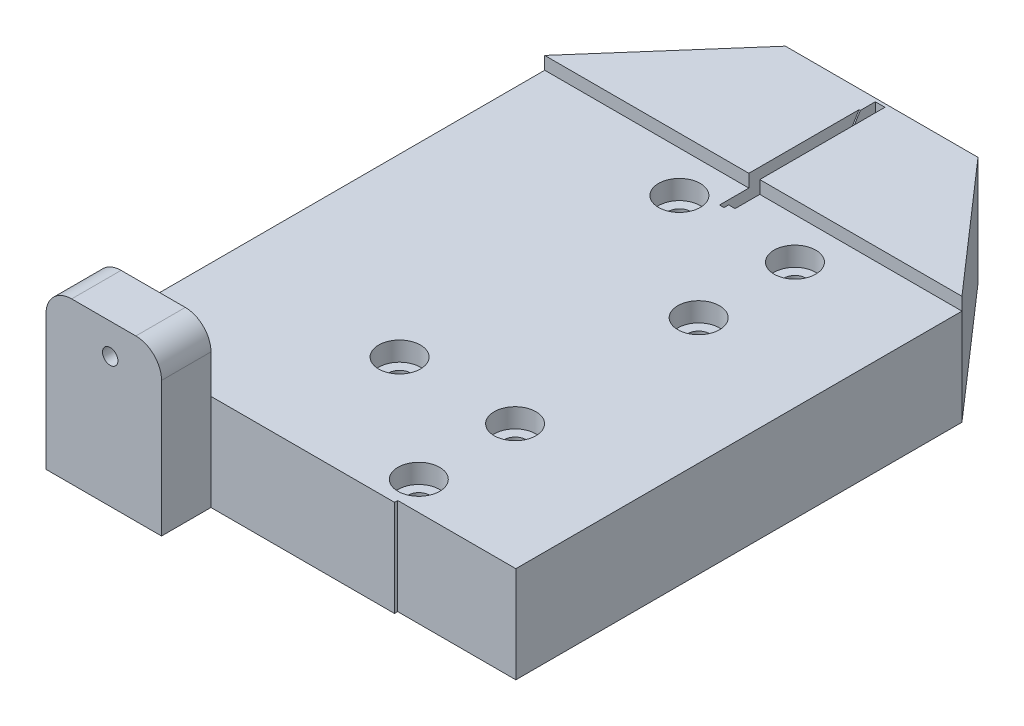
from build123d import *

# Parameters (mm, degrees)
BOSS_EXTRUDE1_DEPTH            = 17
BOSS_EXTRUDE2_START            = 17
SKETCH1_3_W                    = 18
SKETCH1_3_H                    = 7.7
BOSS_EXTRUDE2_DEPTH            = 8
SKETCH9_W                      = 65
SKETCH9_H                      = 70
CUT_EXTRUDE5_DEPTH             = 2
CBORE_FOR_M3_SHCS2_D           = 3.4
CBORE_FOR_M3_SHCS2_CBORE_D     = 6.5
CBORE_FOR_M3_SHCS2_CBORE_DEPTH = 3
SKETCH4_R                      = 1
CUT_EXTRUDE3_DEPTH             = 0.7
CUT_EXTRUDE4_DEPTH             = 0.5
CUT_EXTRUDE4_DEPTH_BACK        = 1
SKETCH6_W                      = 23.342383579
SKETCH6_H                      = 4
CBORE_FOR_M2_SHCS1_D           = 2.4
CBORE_FOR_M2_SHCS1_CBORE_D     = 4.4
CBORE_FOR_M2_SHCS1_CBORE_DEPTH = 2
FILLET1_R                      = 4


with BuildPart() as part:
    # Sketch1 → Boss-Extrude1 (new body)
    with BuildSketch(Plane(origin=(0, 0, 0), x_dir=(1, 0, 0), z_dir=(0, 1, 0))):
        Polygon((32.5, 0.5), (32.5, 70), (15, 90), (-15, 90), (-32.5, 70), (-32.5, -7.7), (-14.5, -7.7), (-14.5, 0), (14.1, 0), (14.1, 0.5), align=None)
    extrude(amount=BOSS_EXTRUDE1_DEPTH)

    # Sketch1<3> → Boss-Extrude2 (add)
    with BuildSketch(Plane(origin=(0, 0, 0), x_dir=(1, 0, 0), z_dir=(0, 1, 0)).offset(BOSS_EXTRUDE2_START)):
        with Locations((-23.5, -3.85)):
            Rectangle(SKETCH1_3_W, SKETCH1_3_H)
    extrude(amount=BOSS_EXTRUDE2_DEPTH)

    # Sketch9 → Cut-Extrude5 (cut)
    with BuildSketch(Plane(origin=(0, 17, 0), x_dir=(1, 0, 0), z_dir=(0, 1, 0))):
        with Locations((0, 35)):
            Rectangle(SKETCH9_W, SKETCH9_H)
    extrude(amount=-CUT_EXTRUDE5_DEPTH, mode=Mode.SUBTRACT)

    # CBORE for M3 SHCS2 (through all)
    with Locations(Plane(origin=(0, 15, 0), x_dir=(1, 0, 0), z_dir=(0, 1, 0))):
        with Locations((-5.12, 20), (12.88, 20), (-5.12, 63.6), (12.88, 63.6), (12.88, 5), (12.88, 48.6)):
            CounterBoreHole(CBORE_FOR_M3_SHCS2_D / 2, CBORE_FOR_M3_SHCS2_CBORE_D / 2, CBORE_FOR_M3_SHCS2_CBORE_DEPTH)

    # Sketch4 → Cut-Extrude3 (cut)
    with BuildSketch(Plane(origin=(0, 0, 0), x_dir=(0, 0, -1), z_dir=(1, 0, 0))):
        with BuildLine():
            ThreePointArc((78.521450009, 2.853281834), (77.510842566, 2.872195508), (77, 2))
            Line((77, 2), (78, 2))
            Line((78, 2), (78.521450009, 2.853281834))
        make_face()
        with BuildLine():
            Line((78, 2), (77, 2))
            ThreePointArc((77, 2), (78, 1), (79, 2))
            ThreePointArc((79, 2), (78.872195508, 2.489157434), (78.521450009, 2.853281834))
            Line((78.521450009, 2.853281834), (78, 2))
        make_face()
        with BuildLine():
            Line((58.012399764, 2.853281834), (57.490949754, 2))
            Line((57.490949754, 2), (58.490949754, 2))
            ThreePointArc((58.490949754, 2), (58.363145263, 2.489157434), (58.012399764, 2.853281834))
        make_face()
        with BuildLine():
            Line((58.490949754, 2), (57.490949754, 2))
            Line((57.490949754, 2), (58.012399764, 2.853281834))
            ThreePointArc((58.012399764, 2.853281834), (56.618754246, 1.510842566), (58.490949754, 2))
        make_face()
        with Locations((57.490949754, 2)):
            Circle(SKETCH4_R)
        with Locations((78, 2)):
            Circle(SKETCH4_R)
        Polygon((57.490949754, 2), (78, 2), (89, 20), (68.490949754, 20), align=None)
    extrude(amount=-CUT_EXTRUDE3_DEPTH, mode=Mode.SUBTRACT)

    # Sketch6 → Cut-Extrude4 (cut, two sides: drawn at the far end of the back side and taken through both)
    with BuildSketch(Plane.ZY.offset(-CUT_EXTRUDE4_DEPTH_BACK)):
        with Locations((-77.828808211, 15)):
            Rectangle(SKETCH6_W, SKETCH6_H)
    extrude(amount=CUT_EXTRUDE4_DEPTH + CUT_EXTRUDE4_DEPTH_BACK, mode=Mode.SUBTRACT)

    # CBORE for M2 SHCS1 (through all)
    with Locations(Plane(origin=(0, 0, 0), x_dir=(-1, 0, 0), z_dir=(0, 0, -1))):
        with Locations((22.5, 20.24)):
            CounterBoreHole(CBORE_FOR_M2_SHCS1_D / 2, CBORE_FOR_M2_SHCS1_CBORE_D / 2, CBORE_FOR_M2_SHCS1_CBORE_DEPTH)

    # Fillet1
    fillet1_edges = [part.edges().sort_by_distance(p)[0] for p in [
        (-32.5, 25, 3.85),
        (-14.5, 25, 3.85),
    ]]
    fillet(fillet1_edges, radius=FILLET1_R)


solid = part.part
